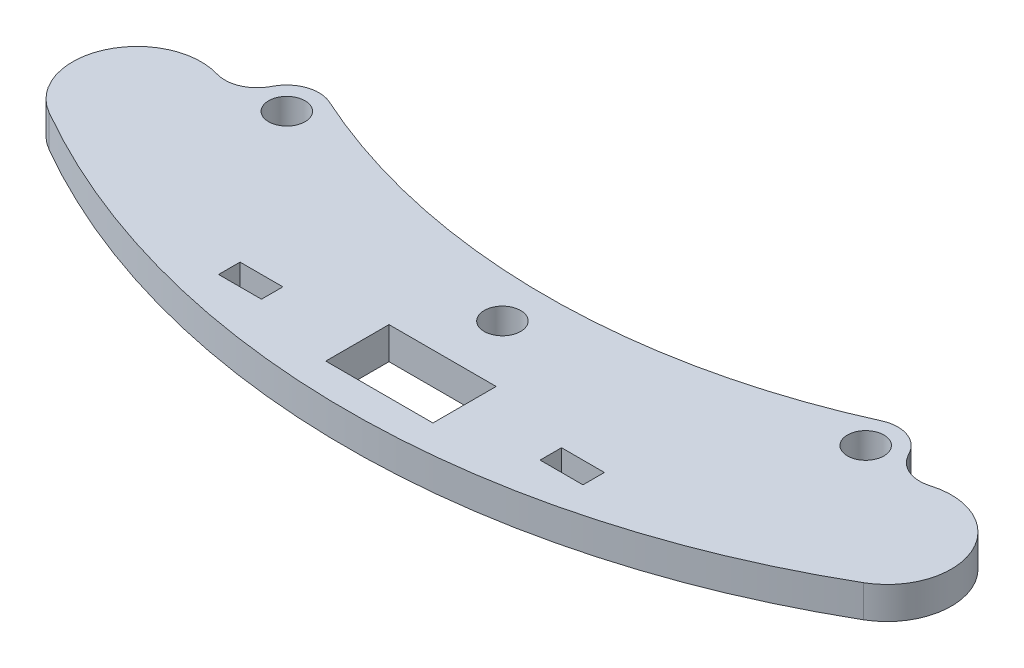
from build123d import *

# Parameters (mm, degrees)
CROQUIS1_R              = 1.7
SALIENTE_EXTRUIR1_DEPTH = 3
CORTAR_EXTRUIR1_REACH   = 88.406
CROQUIS3_W              = 4
CROQUIS3_H              = 2
CROQUIS3_W_2            = 10
CROQUIS3_H_2            = 5.9


with BuildPart() as part:
    # Croquis1 → Saliente-Extruir1 (new body)
    with BuildSketch(Plane(origin=(0, 0, 0), x_dir=(1, 0, 0), z_dir=(0, 1, 0))):
        with BuildLine():
            Line((-29.607107898, -53.127168991), (-29.822053636, -53.49946593))
            ThreePointArc((-29.822053636, -53.49946593), (-31.312291696, -54.787421208), (-33.280086565, -54.873570042))
            ThreePointArc((-33.280086565, -54.873570042), (-40.509483904, -58.24573384), (-38, -65.817930688))
            ThreePointArc((-38, -65.817930688), (0, -76), (38, -65.817930688))
            ThreePointArc((38, -65.817930688), (40.509483904, -58.24573384), (33.280086565, -54.873570042))
            ThreePointArc((33.280086565, -54.873570042), (31.312291696, -54.787421208), (29.822053636, -53.49946593))
            Line((29.822053636, -53.49946593), (29.607107898, -53.127168991))
            ThreePointArc((29.607107898, -53.127168991), (27.954273423, -51.77997422), (25.823903289, -51.871180841))
            ThreePointArc((25.823903289, -51.871180841), (0, -57.458865486), (-25.823903289, -51.871180841))
            ThreePointArc((-25.823903289, -51.871180841), (-27.954273423, -51.77997422), (-29.607107898, -53.127168991))
        make_face()
        with Locations(Location((27.009031687, -54.627168991, 0), (0, 0, 270))):
            Circle(CROQUIS1_R, mode=Mode.SUBTRACT)
        with Locations(Location((0, -61.515130262, 0), (0, 0, 270))):
            Circle(CROQUIS1_R, mode=Mode.SUBTRACT)
        with Locations(Location((-27.009031687, -54.627168991, 0), (0, 0, 270))):
            Circle(CROQUIS1_R, mode=Mode.SUBTRACT)
    extrude(amount=SALIENTE_EXTRUIR1_DEPTH)

    # Croquis3 → Cortar-Extruir1 (cut, up to next)
    with BuildSketch(Plane.XZ, mode=Mode.PRIVATE) as cortar_extruir1_sk1:
        with Locations((15, 70)):
            Rectangle(CROQUIS3_W, CROQUIS3_H)
    cortar_extruir1_tool1 = extrude(cortar_extruir1_sk1.sketch, amount=-CORTAR_EXTRUIR1_REACH, mode=Mode.PRIVATE) & part.part
    # Croquis3 → Cortar-Extruir1 (cut, up to next)
    with BuildSketch(Plane.XZ, mode=Mode.PRIVATE) as cortar_extruir1_sk2:
        with Locations((0, 70.05)):
            Rectangle(CROQUIS3_W_2, CROQUIS3_H_2)
    cortar_extruir1_tool2 = extrude(cortar_extruir1_sk2.sketch, amount=-CORTAR_EXTRUIR1_REACH, mode=Mode.PRIVATE) & part.part
    # Croquis3 → Cortar-Extruir1 (cut, up to next)
    with BuildSketch(Plane.XZ, mode=Mode.PRIVATE) as cortar_extruir1_sk3:
        with Locations((-15, 70)):
            Rectangle(CROQUIS3_W, CROQUIS3_H)
    cortar_extruir1_tool3 = extrude(cortar_extruir1_sk3.sketch, amount=-CORTAR_EXTRUIR1_REACH, mode=Mode.PRIVATE) & part.part
    add(cortar_extruir1_tool1.solids().sort_by_distance((15, 0, 70))[0], mode=Mode.SUBTRACT)
    add(cortar_extruir1_tool2.solids().sort_by_distance((0, 0, 70.05))[0], mode=Mode.SUBTRACT)
    add(cortar_extruir1_tool3.solids().sort_by_distance((-15, 0, 70))[0], mode=Mode.SUBTRACT)


solid = part.part
